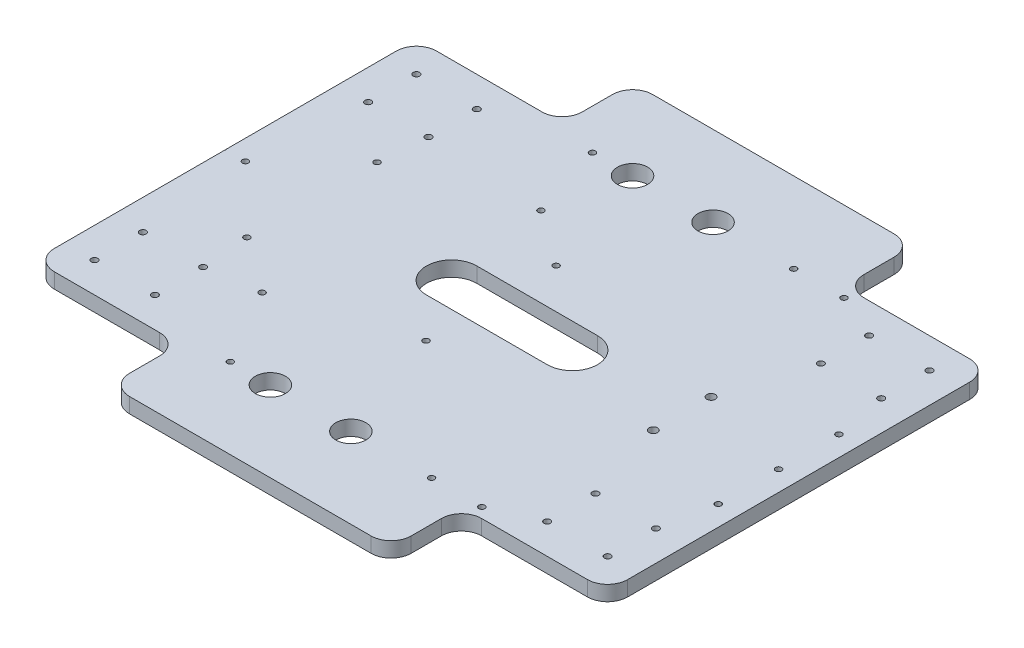
from build123d import *

# Parameters (mm, degrees)
SKETCH_1_W                = 300
SKETCH_1_H                = 300
EXTRUDE_1_DEPTH           = 7.5
SKETCH_2_W                = 80
SKETCH_2_H                = 50
CUT_EXTRUDE_1_DEPTH       = 50
SKETCH_3_R                = 1.6
SKETCH_3_R_2              = 1.600000001
SKETCH_3_R_3              = 1.599999999
CUT_EXTRUDE_2_DEPTH       = 500
CUT_EXTRUDE_4_DEPTH       = 0.01
SKETCH_6_W                = 140
SKETCH_6_H                = 5
CUT_EXTRUDE_5_DEPTH       = 400
SKETCH_7_W                = 140
SKETCH_7_H                = 5
CUT_EXTRUDE_6_DEPTH       = 500
SKETCH_8_W                = 2.5
SKETCH_8_H                = 200
CUT_EXTRUDE_7_DEPTH       = 500
SKETCH_9_W                = 2.5
SKETCH_9_H                = 200
CUT_EXTRUDE_8_DEPTH       = 500
FILLET_1_R                = 10
FILLET_2_R                = 10
FILLET_3_R                = 10
FILLET_4_R                = 10
FILLET_5_R                = 10
FILLET_6_R                = 10
SKETCH_11_R               = 1.5
CUT_EXTRUDE_9_DEPTH       = 500
SKETCH_12_R               = 1.5
CUT_EXTRUDE_10_DEPTH      = 500
CUT_EXTRUDE_11_DEPTH      = 50
SKETCH_14_R               = 5.782308343
SKETCH_14_R_2             = 5.248483765
SKETCH_14_R_3             = 6.275259234
SKETCH_14_R_4             = 6.509804592
SKETCH_14_R_5             = 6.573235723
SKETCH_14_R_6             = 7.165134631
SKETCH_14_R_7             = 4.888351542
SKETCH_14_R_8             = 5.806631969
SKETCH_14_R_9             = 4.239213073
EXTRUDE_2_DEPTH           = 7.5
SKETCH_15_R               = 3.446800016
EXTRUDE_3_DEPTH           = 7.5
SKETCH_16_W               = 57.029416174
SKETCH_16_H               = 109.049491738
EXTRUDE_4_DEPTH           = 7.5
CUT_EXTRUDE_12_DEPTH      = 30
SKETCH_18_R               = 1.5
CUT_EXTRUDE_13_DEPTH      = 10
EXTRUDE_5_DEPTH           = 7.5
SKETCH_20_R               = 0.5
CUT_EXTRUDE_14_DEPTH      = 1000
CUT_EXTRUDE_15_DEPTH      = 207.972220358
CUT_EXTRUDE_15_DEPTH_BACK = 207.972220358
SKETCH_21_OUTSIDE_W       = 379.748
SKETCH_21_OUTSIDE_H       = 374.748
SKETCH_23_R               = 4.616010881
SKETCH_23_R_2             = 4.086725284
SKETCH_23_R_3             = 3.624465814
SKETCH_23_R_4             = 3.978091291
SKETCH_23_W               = 56.227674063
SKETCH_23_H               = 41.422628231
SKETCH_23_W_2             = 51.583888058
SKETCH_23_H_2             = 39.718934523
SKETCH_23_W_3             = 52.565665665
SKETCH_23_H_3             = 44.114209491
EXTRUDE_6_DEPTH           = 7.5
SKETCH_22_R               = 1.6
CUT_EXTRUDE_16_DEPTH      = 1000
SKETCH_24_W               = 28.555531596
SKETCH_24_H               = 14.710425368
SKETCH_24_W_2             = 20.600864098
SKETCH_24_H_2             = 23.364744768
SKETCH_24_W_3             = 21.519352923
SKETCH_24_H_3             = 16.123370595
SKETCH_24_W_4             = 6.855799314
SKETCH_24_H_4             = 7.58099095
SKETCH_24_W_5             = 18.642963804
SKETCH_24_H_5             = 10.332938667
SKETCH_24_W_6             = 12.895127715
SKETCH_24_H_6             = 5.848414039
EXTRUDE_7_DEPTH           = 7.5
SKETCH_25_R               = 1.5
CUT_EXTRUDE_17_DEPTH      = 100
FILLET_7_R                = 10
FILLET_8_R                = 10
SKETCH_26_R               = 0.25
CUT_EXTRUDE_18_DEPTH      = 10
CUT_EXTRUDE_19_DEPTH      = 10
SKETCH_29_R               = 1.5
CUT_EXTRUDE_20_DEPTH      = 200
SKETCH_30_R               = 1.5
CUT_EXTRUDE_21_DEPTH      = 200
SKETCH_31_R               = 1.5
CUT_EXTRUDE_22_DEPTH      = 15
SKETCH_32_R               = 2
CUT_EXTRUDE_23_DEPTH      = 15
SKETCH_33_R               = 1.5
CUT_EXTRUDE_24_DEPTH      = 10
SKETCH_34_W               = 140
SKETCH_34_H               = 35
EXTRUDE_8_DEPTH           = 8
FILLET_9_R                = 10
SKETCH_36_R               = 7.48388229
CUT_EXTRUDE_25_DEPTH      = 10
SKETCH_37_R               = 7.48388229
CUT_EXTRUDE_26_DEPTH      = 10
SKETCH_38_R               = 2
SKETCH_38_R_2             = 2.1
CUT_EXTRUDE_27_DEPTH      = 8
SKETCH_39_R               = 2.1
CUT_EXTRUDE_28_DEPTH      = 8
SKETCH_41_R               = 2
EXTRUDE_9_DEPTH           = 8
SKETCH_42_W               = 397.154342418
SKETCH_42_H               = 301.389568828
CUT_EXTRUDE_29_DEPTH      = 10


with BuildPart() as part:
    # 草图1 → 凸台-拉伸1 (new body)
    with BuildSketch(Plane(origin=(0, 0, 0), x_dir=(1, 0, 0), z_dir=(0, 1, 0))):
        Rectangle(SKETCH_1_W, SKETCH_1_H)
    extrude(amount=EXTRUDE_1_DEPTH)

    # 草图2 → 切除-拉伸1 (cut)
    with BuildSketch(Plane(origin=(0, 0, 0), x_dir=(-1, 0, 0), z_dir=(0, -1, 0))):
        with Locations((-110, -125)):
            Rectangle(SKETCH_2_W, SKETCH_2_H)
        with Locations((-110, 125)):
            Rectangle(SKETCH_2_W, SKETCH_2_H)
        with Locations((110, -125)):
            Rectangle(SKETCH_2_W, SKETCH_2_H)
        with Locations((110, 125)):
            Rectangle(SKETCH_2_W, SKETCH_2_H)
    extrude(amount=-CUT_EXTRUDE_1_DEPTH, mode=Mode.SUBTRACT)

    # 草图3 → 切除-拉伸2 (cut)
    with BuildSketch(Plane.XZ):
        with Locations(Location((132.5, 81.505719169, 0), (0, 0, 270))):
            Circle(SKETCH_3_R)
        with Locations(Location((132.5, 57.505719169, 0), (0, 0, 270))):
            Circle(SKETCH_3_R)
        with Locations(Location((102.5, 81.505719169, 0), (0, 0, 270))):
            Circle(SKETCH_3_R)
        with Locations(Location((102.5, 57.505719169, 0), (0, 0, 270))):
            Circle(SKETCH_3_R)
        with Locations(Location((-102.5, 81.505719169, 0), (0, 0, 270))):
            Circle(SKETCH_3_R_2)
        with Locations(Location((-102.5, 57.505719169, 0), (0, 0, 270))):
            Circle(SKETCH_3_R_2)
        with Locations(Location((-132.5, 81.505719169, 0), (0, 0, 270))):
            Circle(SKETCH_3_R_2)
        with Locations(Location((-132.5, 57.505719169, 0), (0, 0, 270))):
            Circle(SKETCH_3_R_2)
        with Locations(Location((-132.5, -57.505719169, 0), (0, 0, 270))):
            Circle(SKETCH_3_R_3)
        with Locations(Location((-132.5, -81.505719169, 0), (0, 0, 270))):
            Circle(SKETCH_3_R_3)
        with Locations(Location((-102.5, -57.505719169, 0), (0, 0, 270))):
            Circle(SKETCH_3_R_3)
        with Locations(Location((-102.5, -81.505719169, 0), (0, 0, 270))):
            Circle(SKETCH_3_R_3)
        with Locations(Location((132.5, -81.505719169, 0), (0, 0, 270))):
            Circle(SKETCH_3_R)
        with Locations(Location((132.5, -57.505719169, 0), (0, 0, 270))):
            Circle(SKETCH_3_R)
        with Locations(Location((102.5, -57.505719169, 0), (0, 0, 270))):
            Circle(SKETCH_3_R)
        with Locations(Location((102.5, -81.505719169, 0), (0, 0, 270))):
            Circle(SKETCH_3_R)
    extrude(amount=-CUT_EXTRUDE_2_DEPTH, mode=Mode.SUBTRACT)

    # 草图5 → 切除-拉伸4 (cut)
    with BuildSketch(Plane.XZ):
        Polygon((145.77960396, 0), (141.689907669, 4.08969629), (141.689907669, -4.08969629), align=None)
    extrude(amount=-CUT_EXTRUDE_4_DEPTH, mode=Mode.SUBTRACT)

    # 草图6 → 切除-拉伸5 (cut)
    with BuildSketch(Plane(origin=(0, 7.5, 0), x_dir=(1, 0, 0), z_dir=(0, 1, 0))):
        with Locations((0, 147.5)):
            Rectangle(SKETCH_6_W, SKETCH_6_H)
    extrude(amount=-CUT_EXTRUDE_5_DEPTH, mode=Mode.SUBTRACT)

    # 草图7 → 切除-拉伸6 (cut)
    with BuildSketch(Plane(origin=(0, 7.5, 0), x_dir=(1, 0, 0), z_dir=(0, 1, 0))):
        with Locations((0, -147.5)):
            Rectangle(SKETCH_7_W, SKETCH_7_H)
    extrude(amount=-CUT_EXTRUDE_6_DEPTH, mode=Mode.SUBTRACT)

    # 草图8 → 切除-拉伸7 (cut)
    with BuildSketch(Plane(origin=(0, 7.5, 0), x_dir=(1, 0, 0), z_dir=(0, 1, 0))):
        with Locations((-148.75, 0)):
            Rectangle(SKETCH_8_W, SKETCH_8_H)
    extrude(amount=-CUT_EXTRUDE_7_DEPTH, mode=Mode.SUBTRACT)

    # 草图9 → 切除-拉伸8 (cut)
    with BuildSketch(Plane(origin=(0, 7.5, 0), x_dir=(1, 0, 0), z_dir=(0, 1, 0))):
        with Locations((148.75, 0)):
            Rectangle(SKETCH_9_W, SKETCH_9_H)
    extrude(amount=-CUT_EXTRUDE_8_DEPTH, mode=Mode.SUBTRACT)

    # 圆角1
    fillet_1_edges = [part.edges().sort_by_distance(p)[0] for p in [
        (-70, 3.75, 145),
        (70, 3.75, 145),
    ]]
    fillet(fillet_1_edges, radius=FILLET_1_R)

    # 圆角2
    fillet_2_edges = [part.edges().sort_by_distance(p)[0] for p in [
        (-70, 3.75, 100),
        (70, 3.75, 100),
    ]]
    fillet(fillet_2_edges, radius=FILLET_2_R)

    # 圆角3
    fillet_3_edges = [part.edges().sort_by_distance(p)[0] for p in [
        (-147.5, 3.75, 100),
        (147.5, 3.75, 100),
    ]]
    fillet(fillet_3_edges, radius=FILLET_3_R)

    # 圆角4
    fillet_4_edges = [part.edges().sort_by_distance(p)[0] for p in [
        (-147.5, 3.75, -100),
        (147.5, 3.75, -100),
    ]]
    fillet(fillet_4_edges, radius=FILLET_4_R)

    # 圆角5
    fillet_5_edges = [part.edges().sort_by_distance(p)[0] for p in [
        (70, 3.75, -100),
        (-70, 3.75, -100),
    ]]
    fillet(fillet_5_edges, radius=FILLET_5_R)

    # 圆角6
    fillet_6_edges = [part.edges().sort_by_distance(p)[0] for p in [
        (70, 3.75, -145),
        (-70, 3.75, -145),
    ]]
    fillet(fillet_6_edges, radius=FILLET_6_R)

    # 草图11 → 切除-拉伸9 (cut)
    with BuildSketch(Plane.XZ):
        with Locations(Location((-50, 125, 0), (0, 0, 270))):
            Circle(SKETCH_11_R)
    extrude(amount=-CUT_EXTRUDE_9_DEPTH, mode=Mode.SUBTRACT)

    # 草图12 → 切除-拉伸10 (cut)
    with BuildSketch(Plane.XZ):
        with Locations(Location((50, 125, 0), (0, 0, 270))):
            Circle(SKETCH_12_R)
        with Locations(Location((70, 80, 0), (0, 0, 270))):
            Circle(SKETCH_12_R)
        with Locations(Location((70, 0, 0), (0, 0, 270))):
            Circle(SKETCH_12_R)
        with Locations(Location((70, -80, 0), (0, 0, 270))):
            Circle(SKETCH_12_R)
        with Locations(Location((50, -125, 0), (0, 0, 270))):
            Circle(SKETCH_12_R)
        with Locations(Location((-50, -125, 0), (0, 0, 270))):
            Circle(SKETCH_12_R)
        with Locations(Location((-82.5, -85, 0), (0, 0, 270))):
            Circle(SKETCH_12_R)
        with Locations(Location((-132.5, 0, 0), (0, 0, 270))):
            Circle(SKETCH_12_R)
        with Locations(Location((-50, 125, 0), (0, 0, 270))):
            Circle(SKETCH_12_R)
        with Locations(Location((-82.5, 85, 0), (0, 0, 270))):
            Circle(SKETCH_12_R)
    extrude(amount=-CUT_EXTRUDE_10_DEPTH, mode=Mode.SUBTRACT)

    # 草图13 → 切除-拉伸11 (cut)
    with BuildSketch(Plane(origin=(0, 7.5, 0), x_dir=(1, 0, 0), z_dir=(0, 1, 0))):
        with BuildLine():
            Line((-10, -20), (-10, 20))
            ThreePointArc((-10, 20), (0, 30), (10, 20))
            Line((10, 20), (10, -20))
            ThreePointArc((10, -20), (0, -30), (-10, -20))
        make_face()
    extrude(amount=-CUT_EXTRUDE_11_DEPTH, mode=Mode.SUBTRACT)

    # 草图14 → 凸台-拉伸2 (add)
    with BuildSketch(Plane(origin=(0, 7.5, 0), x_dir=(1, 0, 0), z_dir=(0, 1, 0))):
        with Locations((-82.5, 85)):
            Circle(SKETCH_14_R)
        with Locations((-50, 125)):
            Circle(SKETCH_14_R_2)
        with Locations((50, 125)):
            Circle(SKETCH_14_R_3)
        with Locations((69.610460146, 80.278757175)):
            Circle(SKETCH_14_R_4)
        with Locations((70, 0)):
            Circle(SKETCH_14_R_5)
        with Locations((70, -80)):
            Circle(SKETCH_14_R_6)
        with Locations((-50, -125)):
            Circle(SKETCH_14_R_7)
        with Locations((49.518251106, -125)):
            Circle(SKETCH_14_R_8)
        with Locations((-82.5, -85)):
            Circle(SKETCH_14_R_9)
    extrude(amount=-EXTRUDE_2_DEPTH)

    # 草图15 → 凸台-拉伸3 (add)
    with BuildSketch(Plane(origin=(0, 7.5, 0), x_dir=(1, 0, 0), z_dir=(0, 1, 0))):
        with Locations((-132.5, 0)):
            Circle(SKETCH_15_R)
    extrude(amount=-EXTRUDE_3_DEPTH)

    # 草图16 → 凸台-拉伸4 (add)
    with BuildSketch(Plane.XZ):
        Rectangle(SKETCH_16_W, SKETCH_16_H)
    extrude(amount=-EXTRUDE_4_DEPTH)

    # 草图17 → 切除-拉伸12 (cut)
    with BuildSketch(Plane.XZ):
        with BuildLine():
            Line((-30, 12.5), (30, 12.5))
            ThreePointArc((30, 12.5), (42.5, 0), (30, -12.5))
            Line((30, -12.5), (-30, -12.5))
            ThreePointArc((-30, -12.5), (-42.5, 0), (-30, 12.5))
        make_face()
    extrude(amount=-CUT_EXTRUDE_12_DEPTH, mode=Mode.SUBTRACT)

    # 草图18 → 切除-拉伸13 (cut)
    with BuildSketch(Plane.XZ):
        with Locations(Location((-55, 137, 0), (0, 0, 270))):
            Circle(SKETCH_18_R)
        with Locations(Location((55, 137, 0), (0, 0, 270))):
            Circle(SKETCH_18_R)
        with Locations(Location((-137.5, 0, 0), (0, 0, 270))):
            Circle(SKETCH_18_R)
        with Locations(Location((137.5, 0, 0), (0, 0, 270))):
            Circle(SKETCH_18_R)
        with Locations(Location((-55, -137, 0), (0, 0, 270))):
            Circle(SKETCH_18_R)
        with Locations(Location((55, -137, 0), (0, 0, 270))):
            Circle(SKETCH_18_R)
    extrude(amount=-CUT_EXTRUDE_13_DEPTH, mode=Mode.SUBTRACT)

    # 草图19 → 凸台-拉伸5 (add)
    with BuildSketch(Plane.XZ):
        Polygon((140.380015549, 6.180856963), (140.610841427, -5.888038965), (146.94206552, -3.843581185), (146.57933914, 2.355742406), align=None)
    extrude(amount=-EXTRUDE_5_DEPTH)

    # 草图20 → 切除-拉伸14 (cut)
    with BuildSketch(Plane.XZ):
        with Locations((147.5, 0)):
            Circle(SKETCH_20_R)
    extrude(amount=-CUT_EXTRUDE_14_DEPTH, mode=Mode.SUBTRACT)

    # 草图21 outside → 切除-拉伸15 (cut, two sides: drawn at the far end of the back side and taken through both)
    with BuildSketch(Plane.XZ.offset(-CUT_EXTRUDE_15_DEPTH_BACK)):
        Rectangle(SKETCH_21_OUTSIDE_W, SKETCH_21_OUTSIDE_H)
        Polygon((-65, 140), (65, 140), (65, 95), (142.5, 95), (142.5, -95), (65, -95), (65, -140), (-65, -140), (-65, -95), (-142.5, -95), (-142.5, 95), (-65, 95), align=None, mode=Mode.SUBTRACT)
    extrude(amount=CUT_EXTRUDE_15_DEPTH + CUT_EXTRUDE_15_DEPTH_BACK, mode=Mode.SUBTRACT)

    # 草图23 → 凸台-拉伸6 (add)
    with BuildSketch(Plane.XZ):
        with Locations((-132.5, -57.505719169)):
            Circle(SKETCH_23_R)
        with Locations((-102.5, -57.505719169)):
            Circle(SKETCH_23_R_2)
        with Locations((-132.5, -81.505719169)):
            Circle(SKETCH_23_R_3)
        with Locations((-102.5, -81.505719169)):
            Circle(SKETCH_23_R_4)
        with Locations((109.998842213, -66.773107799)):
            Rectangle(SKETCH_23_W, SKETCH_23_H)
        with Locations((112.320735215, 69.046422402)):
            Rectangle(SKETCH_23_W_2, SKETCH_23_H_2)
        with Locations((-111.52219443, 66.848784918)):
            Rectangle(SKETCH_23_W_3, SKETCH_23_H_3)
    extrude(amount=-EXTRUDE_6_DEPTH)

    # 草图22 → 切除-拉伸16 (cut)
    with BuildSketch(Plane.XZ):
        with Locations(Location((-127.5, 80, 0), (0, 0, 270))):
            Circle(SKETCH_22_R)
        with Locations(Location((-97.5, 80, 0), (0, 0, 270))):
            Circle(SKETCH_22_R)
        with Locations(Location((-127.5, 56, 0), (0, 0, 270))):
            Circle(SKETCH_22_R)
        with Locations(Location((-97.5, 56, 0), (0, 0, 270))):
            Circle(SKETCH_22_R)
        with Locations(Location((97.5, 56, 0), (0, 0, 90))):
            Circle(SKETCH_22_R)
        with Locations(Location((127.5, 56, 0), (0, 0, 90))):
            Circle(SKETCH_22_R)
        with Locations(Location((127.5, 80, 0), (0, 0, 90))):
            Circle(SKETCH_22_R)
        with Locations(Location((97.5, 80, 0), (0, 0, 90))):
            Circle(SKETCH_22_R)
        with Locations(Location((97.5, -80, 0), (0, 0, 270))):
            Circle(SKETCH_22_R)
        with Locations(Location((127.5, -80, 0), (0, 0, 270))):
            Circle(SKETCH_22_R)
        with Locations(Location((127.5, -56, 0), (0, 0, 270))):
            Circle(SKETCH_22_R)
        with Locations(Location((97.5, -56, 0), (0, 0, 270))):
            Circle(SKETCH_22_R)
        with Locations(Location((-97.5, -56, 0), (0, 0, 90))):
            Circle(SKETCH_22_R)
        with Locations(Location((-127.5, -56, 0), (0, 0, 90))):
            Circle(SKETCH_22_R)
        with Locations(Location((-97.5, -80, 0), (0, 0, 90))):
            Circle(SKETCH_22_R)
        with Locations(Location((-127.5, -80, 0), (0, 0, 90))):
            Circle(SKETCH_22_R)
    extrude(amount=-CUT_EXTRUDE_16_DEPTH, mode=Mode.SUBTRACT)

    # 草图24 → 凸台-拉伸7 (add)
    with BuildSketch(Plane.XZ):
        with Locations((-126.345327327, -2.879380062)):
            Rectangle(SKETCH_24_W, SKETCH_24_H)
        with Locations((129.738191057, 1.447779638)):
            Rectangle(SKETCH_24_W_2, SKETCH_24_H_2)
        with Locations((50.73825527, -131.209674212)):
            Rectangle(SKETCH_24_W_3, SKETCH_24_H_3)
        with Locations((-54.842271715, -135.480864034)):
            Rectangle(SKETCH_24_W_4, SKETCH_24_H_4)
        with Locations((-50.653635574, 133.626170949)):
            Rectangle(SKETCH_24_W_5, SKETCH_24_H_5)
        with Locations((55.050367874, 135.868433262)):
            Rectangle(SKETCH_24_W_6, SKETCH_24_H_6)
    extrude(amount=-EXTRUDE_7_DEPTH)

    # 草图25 → 切除-拉伸17 (cut)
    with BuildSketch(Plane.XZ):
        with Locations(Location((-50, 132, 0), (0, 0, 270))):
            Circle(SKETCH_25_R)
        with Locations(Location((50, 132, 0), (0, 0, 270))):
            Circle(SKETCH_25_R)
        with Locations(Location((-132.5, 0, 0), (0, 0, 270))):
            Circle(SKETCH_25_R)
        with Locations(Location((132.5, 0, 0), (0, 0, 270))):
            Circle(SKETCH_25_R)
        with Locations(Location((50, -132, 0), (0, 0, 90))):
            Circle(SKETCH_25_R)
        with Locations(Location((-50, -132, 0), (0, 0, 90))):
            Circle(SKETCH_25_R)
    extrude(amount=-CUT_EXTRUDE_17_DEPTH, mode=Mode.SUBTRACT)

    # 圆角7
    fillet_7_edges = [part.edges().sort_by_distance(p)[0] for p in [
        (-142.5, 3.75, 95),
        (-65, 3.75, 95),
        (-65, 3.75, 140),
        (65, 3.75, 140),
        (65, 3.75, 95),
        (142.5, 3.75, 95),
    ]]
    fillet(fillet_7_edges, radius=FILLET_7_R)

    # 圆角8
    fillet_8_edges = [part.edges().sort_by_distance(p)[0] for p in [
        (-65, 3.75, -95),
        (-142.5, 3.75, -95),
        (142.5, 3.75, -95),
        (65, 3.75, -95),
        (65, 3.75, -140),
        (-65, 3.75, -140),
    ]]
    fillet(fillet_8_edges, radius=FILLET_8_R)

    # 草图26 → 切除-拉伸18 (cut)
    with BuildSketch(Plane(origin=(0, 7.5, 0), x_dir=(1, 0, 0), z_dir=(0, 1, 0))):
        with Locations((-142.5, 0)):
            Circle(SKETCH_26_R)
    extrude(amount=-CUT_EXTRUDE_18_DEPTH, mode=Mode.SUBTRACT)

    # 草图28 → 切除-拉伸19 (cut)
    with BuildSketch(Plane(origin=(0, 7.5, 0), x_dir=(1, 0, 0), z_dir=(0, 1, 0))):
        Polygon((-132.5, 95), (132.5, 95), (99.577100294, 183.323578111), (-104.870394975, 176.934593884), align=None)
        Polygon((-86.638595946, -95), (91.644780197, -95), (76.322211303, -162.508201256), (-68.226458863, -151.844542526), align=None)
    extrude(amount=-CUT_EXTRUDE_19_DEPTH, mode=Mode.SUBTRACT)

    # 草图29 → 切除-拉伸20 (cut)
    with BuildSketch(Plane.XZ):
        with Locations(Location((-50, -90, 0), (0, 0, 270))):
            Circle(SKETCH_29_R)
        with Locations(Location((50, -90, 0), (0, 0, 270))):
            Circle(SKETCH_29_R)
    cut_extrude_20 = extrude(amount=-CUT_EXTRUDE_20_DEPTH, mode=Mode.SUBTRACT)

    # 镜向1: 切除-拉伸20 across plane
    add(cut_extrude_20.mirror(Plane.XY), mode=Mode.SUBTRACT)

    # 草图30 → 切除-拉伸21 (cut)
    with BuildSketch(Plane(origin=(0, 7.5, 0), x_dir=(1, 0, 0), z_dir=(0, 1, 0))):
        with Locations(Location((132.5, 30, 0), (0, 0, 270))):
            Circle(SKETCH_30_R)
        with Locations(Location((132.5, -30, 0), (0, 0, 270))):
            Circle(SKETCH_30_R)
    extrude(amount=-CUT_EXTRUDE_21_DEPTH, mode=Mode.SUBTRACT)

    # 草图31 → 切除-拉伸22 (cut)
    with BuildSketch(Plane(origin=(0, 7.5, 0), x_dir=(1, 0, 0), z_dir=(0, 1, 0))):
        with Locations(Location((75, 90, 0), (0, 0, 270))):
            Circle(SKETCH_31_R)
        with Locations(Location((75, -90, 0), (0, 0, 270))):
            Circle(SKETCH_31_R)
    extrude(amount=-CUT_EXTRUDE_22_DEPTH, mode=Mode.SUBTRACT)

    # 草图32 → 切除-拉伸23 (cut)
    with BuildSketch(Plane(origin=(0, 7.5, 0), x_dir=(1, 0, 0), z_dir=(0, 1, 0))):
        with Locations(Location((75, 0, 0), (0, 0, 270))):
            Circle(SKETCH_32_R)
    extrude(amount=-CUT_EXTRUDE_23_DEPTH, mode=Mode.SUBTRACT)

    # 草图33 → 切除-拉伸24 (cut)
    with BuildSketch(Plane(origin=(0, 7.5, 0), x_dir=(1, 0, 0), z_dir=(0, 1, 0))):
        with Locations(Location((-99.413384154, 32.328188876, 0), (0, 0, 270))):
            Circle(SKETCH_33_R)
        with Locations(Location((-37.921514772, 52.308108396, 0), (0, 0, 270))):
            Circle(SKETCH_33_R)
        with Locations(Location((-10.421514772, 32.328188876, 0), (0, 0, 270))):
            Circle(SKETCH_33_R)
        with Locations(Location((-10.421514772, -32.328188876, 0), (0, 0, 270))):
            Circle(SKETCH_33_R)
        with Locations(Location((-71.913384154, -52.308108396, 0), (0, 0, 270))):
            Circle(SKETCH_33_R)
        with Locations(Location((-99.413384154, -32.328188876, 0), (0, 0, 270))):
            Circle(SKETCH_33_R)
    extrude(amount=-CUT_EXTRUDE_24_DEPTH, mode=Mode.SUBTRACT)

    # 草图34 → 凸台-拉伸8 (add)
    with BuildSketch(Plane(origin=(0, 7.5, 0), x_dir=(1, 0, 0), z_dir=(0, 1, 0))):
        with Locations((-0.081551926, -112.5)):
            Rectangle(SKETCH_34_W, SKETCH_34_H)
        with Locations((-0.081551926, 112.5)):
            Rectangle(SKETCH_34_W, SKETCH_34_H)
    extrude(amount=-EXTRUDE_8_DEPTH)

    # 圆角9
    fillet_9_edges = [part.edges().sort_by_distance(p)[0] for p in [
        (69.918448074, 3.75, 95),
        (-70.081551926, 3.75, 95),
        (-70.081551926, 3.5, 130),
        (69.918448074, 3.5, 130),
        (69.918448074, 3.75, -95),
        (-70.081551926, 3.75, -95),
        (-70.081551926, 3.5, -130),
        (69.918448074, 3.5, -130),
    ]]
    fillet(fillet_9_edges, radius=FILLET_9_R)

    # 草图36 → 切除-拉伸25 (cut)
    with BuildSketch(Plane(origin=(0, 7.5, 0), x_dir=(1, 0, 0), z_dir=(0, 1, 0))):
        with Locations(Location((9.918448074, 90, 0), (0, 0, 270))):
            Circle(SKETCH_36_R)
    extrude(amount=-CUT_EXTRUDE_25_DEPTH, mode=Mode.SUBTRACT)

    # 草图37 → 切除-拉伸26 (cut)
    with BuildSketch(Plane(origin=(0, 7.5, 0), x_dir=(1, 0, 0), z_dir=(0, 1, 0))):
        with Locations(Location((9.918448074, 90, 0), (0, 0, 270))):
            Circle(SKETCH_37_R)
        with Locations(Location((-30.081551926, 90, 0), (0, 0, 270))):
            Circle(SKETCH_37_R)
        with Locations(Location((9.918448074, -90, 0), (0, 0, 270))):
            Circle(SKETCH_37_R)
        with Locations(Location((-30.081551926, -90, 0), (0, 0, 270))):
            Circle(SKETCH_37_R)
    extrude(amount=-CUT_EXTRUDE_26_DEPTH, mode=Mode.SUBTRACT)

    # 草图38 → 切除-拉伸27 (cut)
    with BuildSketch(Plane(origin=(0, 7.5, 0), x_dir=(1, 0, 0), z_dir=(0, 1, 0))):
        with Locations(Location((75, 0, 0), (0, 0, 270))):
            Circle(SKETCH_38_R)
        with Locations(Location((84.6, -14.35, 0), (0, 0, 270))):
            Circle(SKETCH_38_R_2)
    extrude(amount=-CUT_EXTRUDE_27_DEPTH, mode=Mode.SUBTRACT)

    # 草图39 → 切除-拉伸28 (cut)
    with BuildSketch(Plane(origin=(0, 7.5, 0), x_dir=(1, 0, 0), z_dir=(0, 1, 0))):
        with Locations(Location((84.6, 14.35, 0), (0, 0, 270))):
            Circle(SKETCH_39_R)
    extrude(amount=-CUT_EXTRUDE_28_DEPTH, mode=Mode.SUBTRACT)

    # 草图41 → 凸台-拉伸9 (add)
    with BuildSketch(Plane(origin=(0, 7.5, 0), x_dir=(1, 0, 0), z_dir=(0, 1, 0))):
        with Locations(Location((75, 0, 0), (0, 0, 270))):
            Circle(SKETCH_41_R)
    extrude(amount=-EXTRUDE_9_DEPTH)

    # 草图42 → 切除-拉伸29 (cut)
    with BuildSketch(Plane.XZ):
        Rectangle(SKETCH_42_W, SKETCH_42_H)
    extrude(amount=CUT_EXTRUDE_29_DEPTH, mode=Mode.SUBTRACT)


solid = part.part
